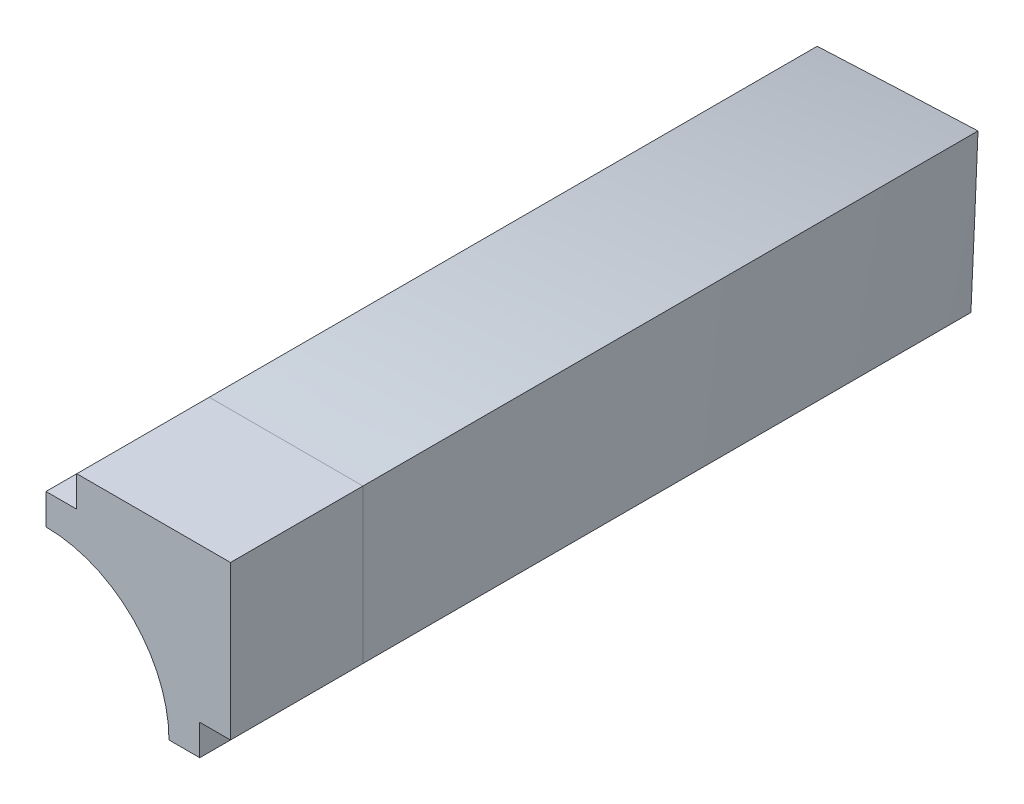
from build123d import *

# Parameters (mm, degrees)
BOSS_EXTRUDE1_DEPTH     = 21.542835
BOSS_EXTRUDE2_DEPTH     = 10
CUT_EXTRUDE1_DEPTH      = 499.850627911
CUT_EXTRUDE1_DEPTH_BACK = 499.850627911


with BuildPart() as part:
    # Sketch1 → Boss-Extrude1 (new body)
    with BuildSketch(Plane.XY):
        with BuildLine():
            Line((325, 305), (330, 305))
            Line((330, 305), (330, 310))
            Line((330, 310), (335, 310))
            Line((335, 310), (335, 335))
            Line((335, 335), (310, 335))
            Line((310, 335), (310, 330))
            Line((310, 330), (305, 330))
            Line((305, 330), (305, 325))
            ThreePointArc((305, 325), (319.142135624, 319.142135624), (325, 305))
        make_face()
    extrude(amount=-BOSS_EXTRUDE1_DEPTH)

    # Sweep1: sweep along a path in Sketch4
    with BuildLine() as sweep1_path:  # in the path sketch's own coordinates; laid on its plane below (add() does not lay a ready-made edge on the line's plane)
        add(Edge.make_bspline(
            [(-451.335136524, 21.542835377), (-451.335136524, 31.597277677), (-450.769218924, 41.609278538), (-449.364991072, 54.072020233), (-449.049247381, 56.56195136), (-448.348004117, 61.536582216), (-447.962412108, 64.021270218), (-446.706547924, 71.43765829), (-445.735912211, 76.341798657), (-442.435917173, 90.937501087), (-439.719159471, 100.512551851), (-433.29802909, 119.365625027), (-429.593533113, 128.643610357), (-425.407688353, 137.776828505)],
            knots=[0, 0, 0, 0, 0.25, 0.25, 0.3125, 0.3125, 0.375, 0.375, 0.5, 0.5, 0.75, 0.75, 1, 1, 1, 1], degree=3))
    # Sketch3 → Sweep1 (sweep)
    with BuildSketch(Plane(origin=(0, 0, -21.542835377), x_dir=(-1, 0, 0), z_dir=(0, 0, -1))):
        with BuildLine():
            Line((-305, 325), (-305, 330))
            Line((-305, 330), (-310, 330))
            Line((-310, 330), (-310, 335))
            Line((-310, 335), (-335, 335))
            Line((-335, 335), (-335, 310))
            Line((-335, 310), (-330, 310))
            Line((-330, 310), (-330, 305))
            Line((-330, 305), (-325, 305))
            ThreePointArc((-325, 305), (-319.142135624, 319.142135624), (-305, 325))
        make_face()
    sweep(path=Plane(origin=(0, 0, 0), x_dir=(-0.7071067811865475, -0.7071067811865477, 0), z_dir=(0.7071067811865477, -0.7071067811865475, 0)) * sweep1_path.line)

    # Sketch5 → Boss-Extrude2 (add)
    with BuildSketch(Plane(origin=(15.317047485, 15.317047485, 47.264032239), x_dir=(-0.9556185144061383, 0.09082416635485616, 0.28025742760924405), z_dir=(-0.29460694989121566, -0.2946069498912101, -0.9090728739499342))):
        with BuildLine():
            Line((-284.345799591, 333.810609221), (-284.107924527, 338.804947561))
            Line((-284.107924527, 338.804947561), (-289.102262867, 339.042822624))
            Line((-289.102262867, 339.042822624), (-288.864387803, 344.037160964))
            Line((-288.864387803, 344.037160964), (-313.836079503, 345.226536284))
            Line((-313.836079503, 345.226536284), (-315.025454822, 320.254844584))
            Line((-315.025454822, 320.254844584), (-310.031116482, 320.01696952))
            Line((-310.031116482, 320.01696952), (-310.268991546, 315.02263118))
            Line((-310.268991546, 315.02263118), (-305.274653206, 314.784756116))
            ThreePointArc((-305.274653206, 314.784756116), (-298.750609594, 328.632190175), (-284.345799591, 333.810609221))
        make_face()
    extrude(amount=BOSS_EXTRUDE2_DEPTH)

    # Sketch6 → Cut-Extrude1 (cut, two sides: drawn at the far end of the back side and taken through both)
    with BuildSketch(Plane(origin=(0, 0, 0), x_dir=(1, 0, 0), z_dir=(0, 1, 0)).offset(-CUT_EXTRUDE1_DEPTH_BACK)):
        Polygon((256.412727717, 138.692764215), (356.796435359, 138.692764215), (308.482082305, 192.061065101), align=None)
    extrude(amount=CUT_EXTRUDE1_DEPTH + CUT_EXTRUDE1_DEPTH_BACK, mode=Mode.SUBTRACT)


solid = part.part
